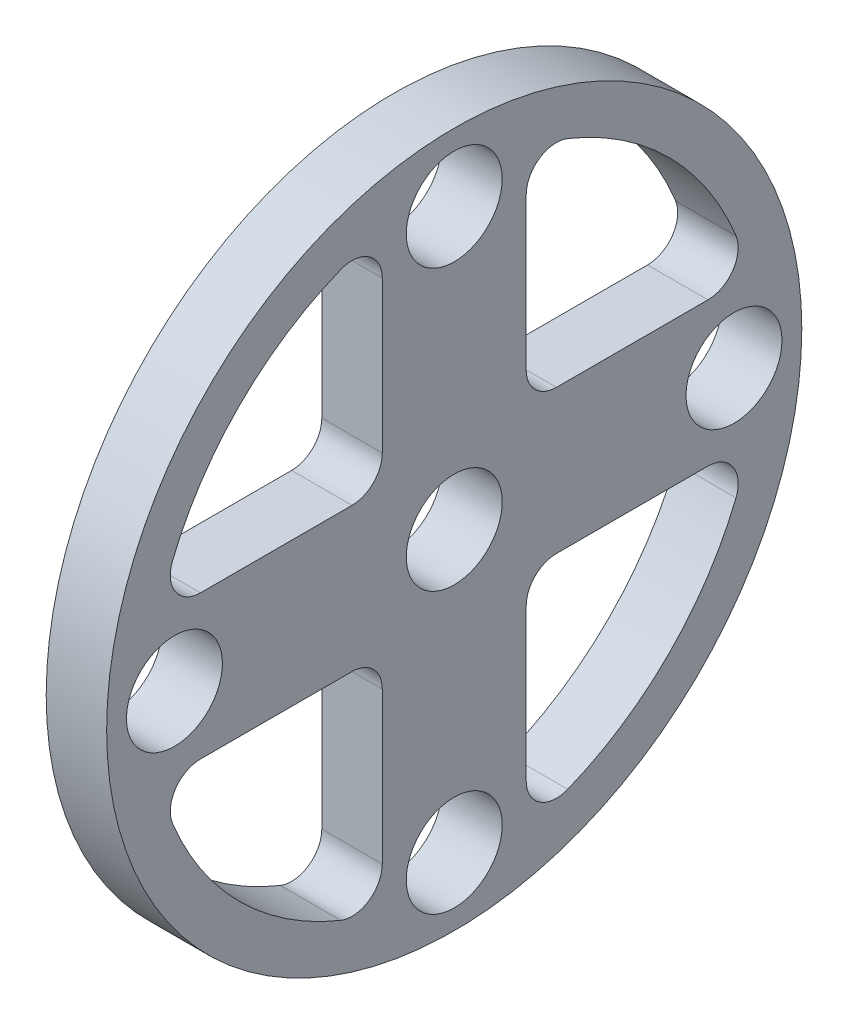
from build123d import *

# Parameters (mm, degrees)
SKETCH1_R           = 23
SKETCH1_R_2         = 3.175
BOSS_EXTRUDE1_DEPTH = 4


with BuildPart() as part:
    # Sketch1 → Boss-Extrude1 (new body)
    with BuildSketch(Plane(origin=(0, 0, 0), x_dir=(0, 0, -1), z_dir=(1, 0, 0))):
        Circle(SKETCH1_R)
        Circle(SKETCH1_R_2, mode=Mode.SUBTRACT)
        with Locations((0, 18.5125)):
            Circle(SKETCH1_R_2, mode=Mode.SUBTRACT)
        with Locations((-18.5125, 0)):
            Circle(SKETCH1_R_2, mode=Mode.SUBTRACT)
        with Locations((0, -18.5125)):
            Circle(SKETCH1_R_2, mode=Mode.SUBTRACT)
        with Locations((18.5125, 0)):
            Circle(SKETCH1_R_2, mode=Mode.SUBTRACT)
        with BuildLine():
            Line((4.7625, 6.7625), (4.7625, 16.789240416))
            ThreePointArc((4.7625, 16.789240416), (5.643231296, 18.446719698), (7.509737569, 18.644405103))
            ThreePointArc((7.509737569, 18.644405103), (14.212846302, 14.212846302), (18.644405103, 7.509737569))
            ThreePointArc((18.644405103, 7.509737569), (18.446719698, 5.643231296), (16.789240416, 4.7625))
            Line((16.789240416, 4.7625), (6.7625, 4.7625))
            ThreePointArc((6.7625, 4.7625), (5.348286438, 5.348286438), (4.7625, 6.7625))
        make_face(mode=Mode.SUBTRACT)
        with BuildLine():
            Line((6.7625, -4.7625), (16.789240416, -4.7625))
            ThreePointArc((16.789240416, -4.7625), (18.446719698, -5.643231296), (18.644405103, -7.509737569))
            ThreePointArc((18.644405103, -7.509737569), (14.212846302, -14.212846302), (7.509737569, -18.644405103))
            ThreePointArc((7.509737569, -18.644405103), (5.643231296, -18.446719698), (4.7625, -16.789240416))
            Line((4.7625, -16.789240416), (4.7625, -6.7625))
            ThreePointArc((4.7625, -6.7625), (5.348286438, -5.348286438), (6.7625, -4.7625))
        make_face(mode=Mode.SUBTRACT)
        with BuildLine():
            Line((-4.7625, -6.7625), (-4.7625, -16.789240416))
            ThreePointArc((-4.7625, -16.789240416), (-5.643231296, -18.446719698), (-7.509737569, -18.644405103))
            ThreePointArc((-7.509737569, -18.644405103), (-14.212846302, -14.212846302), (-18.644405103, -7.509737569))
            ThreePointArc((-18.644405103, -7.509737569), (-18.446719698, -5.643231296), (-16.789240416, -4.7625))
            Line((-16.789240416, -4.7625), (-6.7625, -4.7625))
            ThreePointArc((-6.7625, -4.7625), (-5.348286438, -5.348286438), (-4.7625, -6.7625))
        make_face(mode=Mode.SUBTRACT)
        with BuildLine():
            Line((-6.7625, 4.7625), (-16.789240416, 4.7625))
            ThreePointArc((-16.789240416, 4.7625), (-18.446719698, 5.643231296), (-18.644405103, 7.509737569))
            ThreePointArc((-18.644405103, 7.509737569), (-14.212846302, 14.212846302), (-7.509737569, 18.644405103))
            ThreePointArc((-7.509737569, 18.644405103), (-5.643231296, 18.446719698), (-4.7625, 16.789240416))
            Line((-4.7625, 16.789240416), (-4.7625, 6.7625))
            ThreePointArc((-4.7625, 6.7625), (-5.348286438, 5.348286438), (-6.7625, 4.7625))
        make_face(mode=Mode.SUBTRACT)
    extrude(amount=BOSS_EXTRUDE1_DEPTH)


solid = part.part
